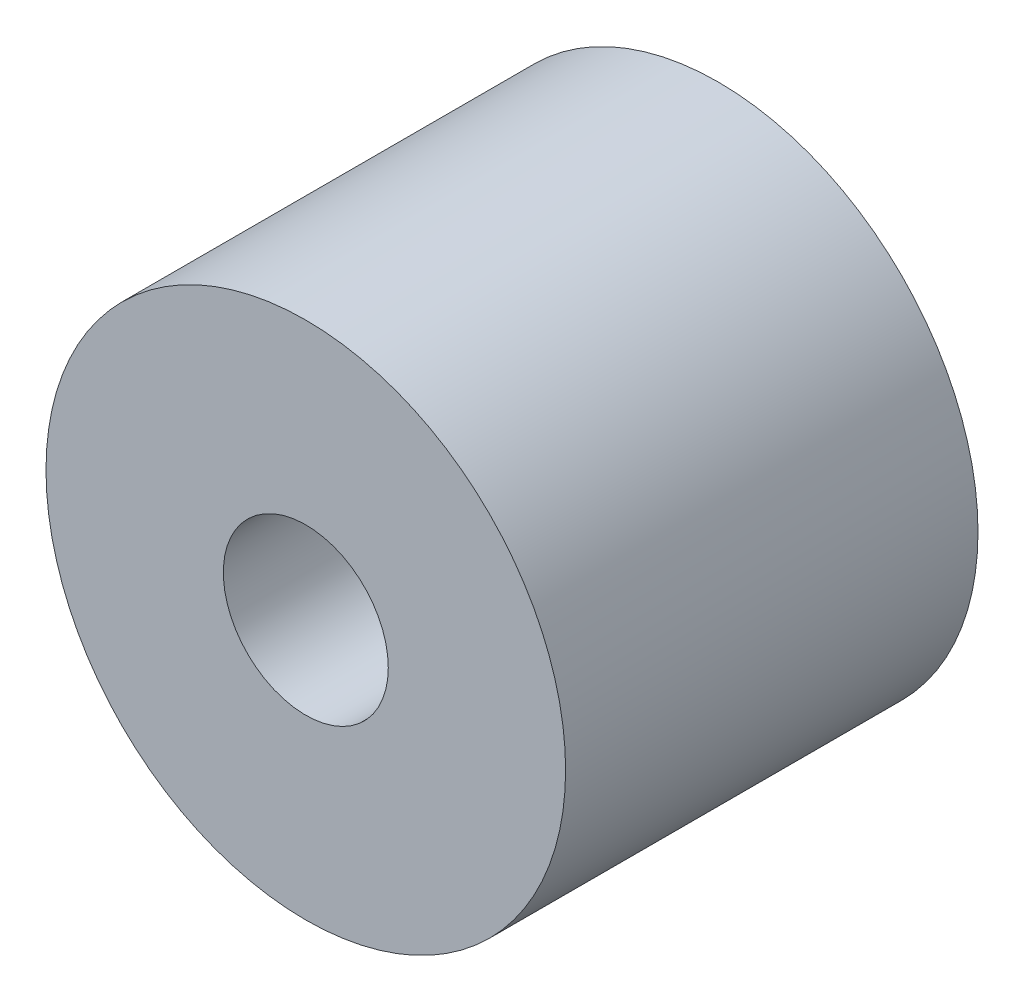
from build123d import *

# Parameters (mm, degrees)
SKETCH1_R           = 15.75
SKETCH1_R_2         = 5
BOSS_EXTRUDE1_DEPTH = 25


with BuildPart() as part:
    # Sketch1 → Boss-Extrude1 (new body)
    with BuildSketch(Plane.XY):
        Circle(SKETCH1_R)
        Circle(SKETCH1_R_2, mode=Mode.SUBTRACT)
    extrude(amount=BOSS_EXTRUDE1_DEPTH)


solid = part.part
